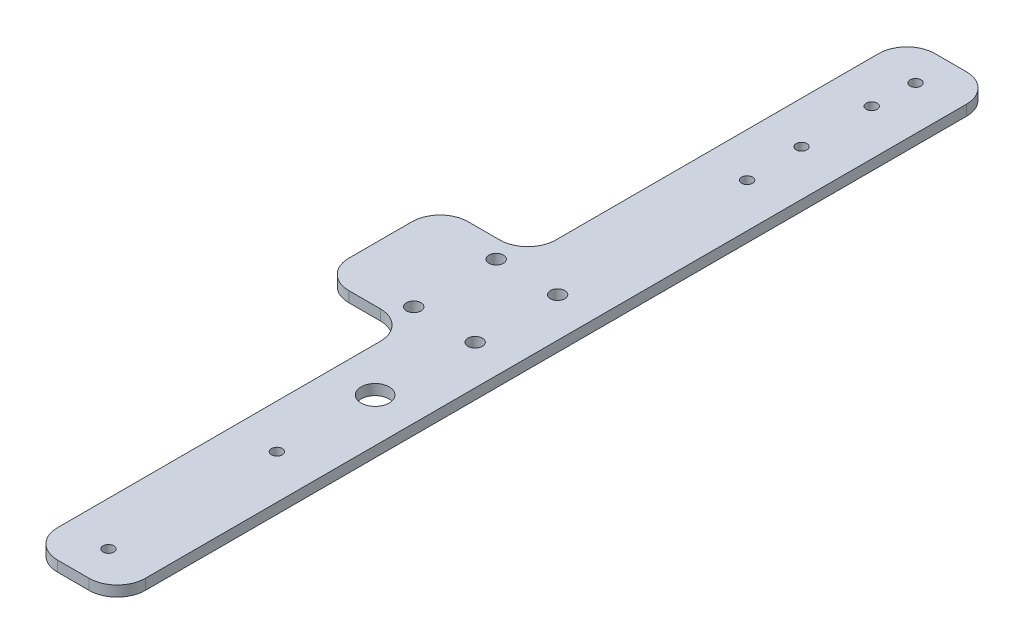
from build123d import *

# Parameters (mm, degrees)
SKETCH_1_W          = 25
SKETCH_1_H          = 34
SKETCH_1_H_2        = 108
EXTRUDE_1_DEPTH     = 3
SKETCH_2_R          = 2.05
SKETCH_2_R_2        = 1.55
CUT_EXTRUDE_1_DEPTH = 10
SKETCH_3_R          = 1.55
CUT_EXTRUDE_2_DEPTH = 10
FILLET_1_R          = 8
SKETCH_4_R          = 4
CUT_EXTRUDE_4_DEPTH = 10


with BuildPart() as part:
    # 草图1 → 凸台-拉伸1 (new body)
    with BuildSketch(Plane(origin=(0, 0, 0), x_dir=(1, 0, 0), z_dir=(0, 1, 0))):
        with Locations((-25, 0)):
            Rectangle(SKETCH_1_W, SKETCH_1_H)
        with Locations((0, 71)):
            Rectangle(SKETCH_1_W, SKETCH_1_H_2)
        Rectangle(SKETCH_1_W, SKETCH_1_H)
        with Locations((0, -71)):
            Rectangle(SKETCH_1_W, SKETCH_1_H_2)
    extrude(amount=EXTRUDE_1_DEPTH)

    # 草图2 → 切除-拉伸1 (cut)
    with BuildSketch(Plane(origin=(0, 0, 0), x_dir=(-1, 0, 0), z_dir=(0, -1, 0))):
        with Locations(Location((-1.25, -11.75, 0), (0, 0, 90))):
            Circle(SKETCH_2_R)
        with Locations(Location((-1.25, 11.75, 0), (0, 0, 90))):
            Circle(SKETCH_2_R)
        with Locations(Location((16.25, 11.75, 0), (0, 0, 90))):
            Circle(SKETCH_2_R)
        with Locations(Location((16.25, -11.75, 0), (0, 0, 90))):
            Circle(SKETCH_2_R)
        with Locations(Location((0, -115, 0), (0, 0, 90))):
            Circle(SKETCH_2_R_2)
        with Locations(Location((0, -67, 0), (0, 0, 90))):
            Circle(SKETCH_2_R_2)
        with Locations(Location((0, 115, 0), (0, 0, 270))):
            Circle(SKETCH_2_R_2)
        with Locations(Location((0, 67, 0), (0, 0, 270))):
            Circle(SKETCH_2_R_2)
    extrude(amount=-CUT_EXTRUDE_1_DEPTH, mode=Mode.SUBTRACT)

    # 草图3 → 切除-拉伸2 (cut)
    with BuildSketch(Plane(origin=(0, 0, 0), x_dir=(-1, 0, 0), z_dir=(0, -1, 0))):
        with Locations(Location((0.5, 83, 0), (0, 0, 90))):
            Circle(SKETCH_3_R)
        with Locations(Location((0.5, 103, 0), (0, 0, 90))):
            Circle(SKETCH_3_R)
    extrude(amount=-CUT_EXTRUDE_2_DEPTH, mode=Mode.SUBTRACT)

    # 圆角1
    fillet_1_edges = [part.edges().sort_by_distance(p)[0] for p in [
        (-37.5, 1.5, -17),
        (-12.5, 1.5, -17),
        (-12.5, 1.5, -125),
        (12.5, 1.5, -125),
        (12.5, 1.5, 125),
        (-12.5, 1.5, 125),
        (-12.5, 1.5, 17),
        (-37.5, 1.5, 17),
    ]]
    fillet(fillet_1_edges, radius=FILLET_1_R)

    # 草图4 → 切除-拉伸4 (cut)
    with BuildSketch(Plane(origin=(0, 0, 0), x_dir=(1, 0, 0), z_dir=(0, 1, 0))):
        with Locations(Location((0, -39, 0), (0, 0, 270))):
            Circle(SKETCH_4_R)
    extrude(amount=CUT_EXTRUDE_4_DEPTH, mode=Mode.SUBTRACT)


solid = part.part
